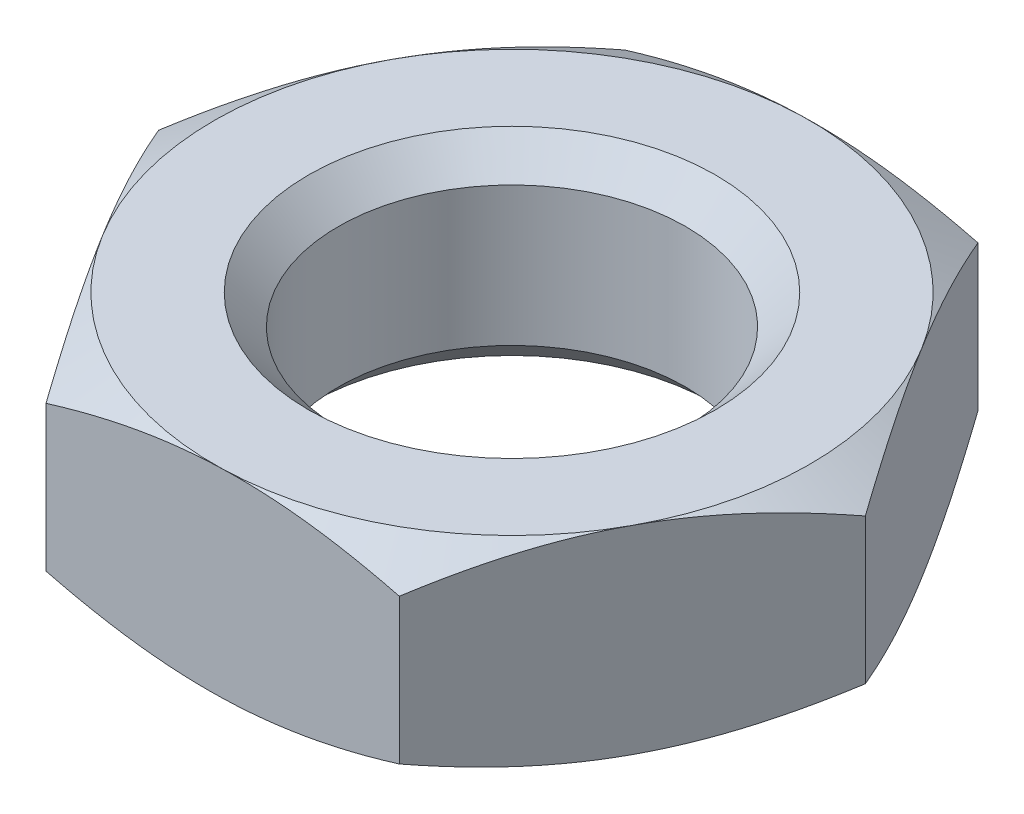
from build123d import *

# Parameters (mm, degrees)
SKETCH1_R           = 1.75
BOSS_EXTRUDE1_DEPTH = 2
SKETCH2_OUTSIDE_W   = 626.732
SKETCH2_OUTSIDE_H   = 625.9
SKETCH2_OUTSIDE_R   = 3
CUT_EXTRUDE1_DEPTH  = 177.8
CUT_EXTRUDE1_DRAFT  = -60
SKETCH3_OUTSIDE_W   = 626.732
SKETCH3_OUTSIDE_H   = 625.9
SKETCH3_OUTSIDE_R   = 3
CUT_EXTRUDE2_DEPTH  = 177.8
CUT_EXTRUDE2_DRAFT  = -60
CHAMFER1_SIZE       = 0.3
CHAMFER2_SIZE       = 0.3


with BuildPart() as part:
    # Sketch1 → Boss-Extrude1 (new body)
    with BuildSketch(Plane(origin=(0, 0, 0), x_dir=(1, 0, 0), z_dir=(0, 1, 0))):
        Polygon((1.647438499, 3.047285085), (-1.815307047, 2.950366134), (-3.462745546, -0.096918951), (-1.647438499, -3.047285085), (1.815307047, -2.950366134), (3.462745546, 0.096918951), align=None)
        with Locations(Location((0, 0, 0), (0, 0, 270))):
            Circle(SKETCH1_R, mode=Mode.SUBTRACT)
    extrude(amount=BOSS_EXTRUDE1_DEPTH)


with BuildPart() as cut_extrude1_tool:
    # Sketch2 outside → Cut-Extrude1 (with draft: the straight prism first)
    with BuildSketch(Plane(origin=(0, 2, 0), x_dir=(1, 0, 0), z_dir=(0, 1, 0))):
        Rectangle(SKETCH2_OUTSIDE_W, SKETCH2_OUTSIDE_H)
        Circle(SKETCH2_OUTSIDE_R, mode=Mode.SUBTRACT)
    extrude(amount=-CUT_EXTRUDE1_DEPTH)
    # Cut-Extrude1: the draft: its side faces are tilted about the plane it starts from
    cut_extrude1_sides = [cut_extrude1_tool.faces().sort_by_distance(p)[0] for p in [
        (0, -86.9, 312.95),
        (313.366, -86.9, 0),
        (0, -86.9, -312.95),
        (-313.366, -86.9, 0),
        (-3, -86.9, 0),
    ]]
    draft(cut_extrude1_sides, Plane(origin=(0, 2, 0), x_dir=(1, 0, 0), z_dir=(0, 1, 0)), CUT_EXTRUDE1_DRAFT)


with BuildPart() as part_1:
    add(part.part)

    # Cut-Extrude1: cut by cut_extrude1_tool
    add(cut_extrude1_tool.part, mode=Mode.SUBTRACT)


with BuildPart() as cut_extrude2_tool:
    # Sketch3 outside → Cut-Extrude2 (with draft: the straight prism first)
    with BuildSketch(Plane.XZ):
        Rectangle(SKETCH3_OUTSIDE_W, SKETCH3_OUTSIDE_H)
        Circle(SKETCH3_OUTSIDE_R, mode=Mode.SUBTRACT)
    extrude(amount=-CUT_EXTRUDE2_DEPTH)
    # Cut-Extrude2: the draft: its side faces are tilted about the plane it starts from
    cut_extrude2_sides = [cut_extrude2_tool.faces().sort_by_distance(p)[0] for p in [
        (0, 88.9, -312.95),
        (313.366, 88.9, 0),
        (0, 88.9, 312.95),
        (-313.366, 88.9, 0),
        (-3, 88.9, 0),
    ]]
    draft(cut_extrude2_sides, Plane.XZ, CUT_EXTRUDE2_DRAFT)


with BuildPart() as part_2:
    add(part_1.part)

    # Cut-Extrude2: cut by cut_extrude2_tool
    add(cut_extrude2_tool.part, mode=Mode.SUBTRACT)

    # Chamfer1
    chamfer1_edges = [part_2.edges().sort_by_distance(p)[0] for p in [
        (0, 2, -1.75),
    ]]
    chamfer(chamfer1_edges, length=CHAMFER1_SIZE)

    # Chamfer2
    chamfer2_edges = [part_2.edges().sort_by_distance(p)[0] for p in [
        (0, 0, -1.75),
    ]]
    chamfer(chamfer2_edges, length=CHAMFER2_SIZE)


solid = part_2.part
